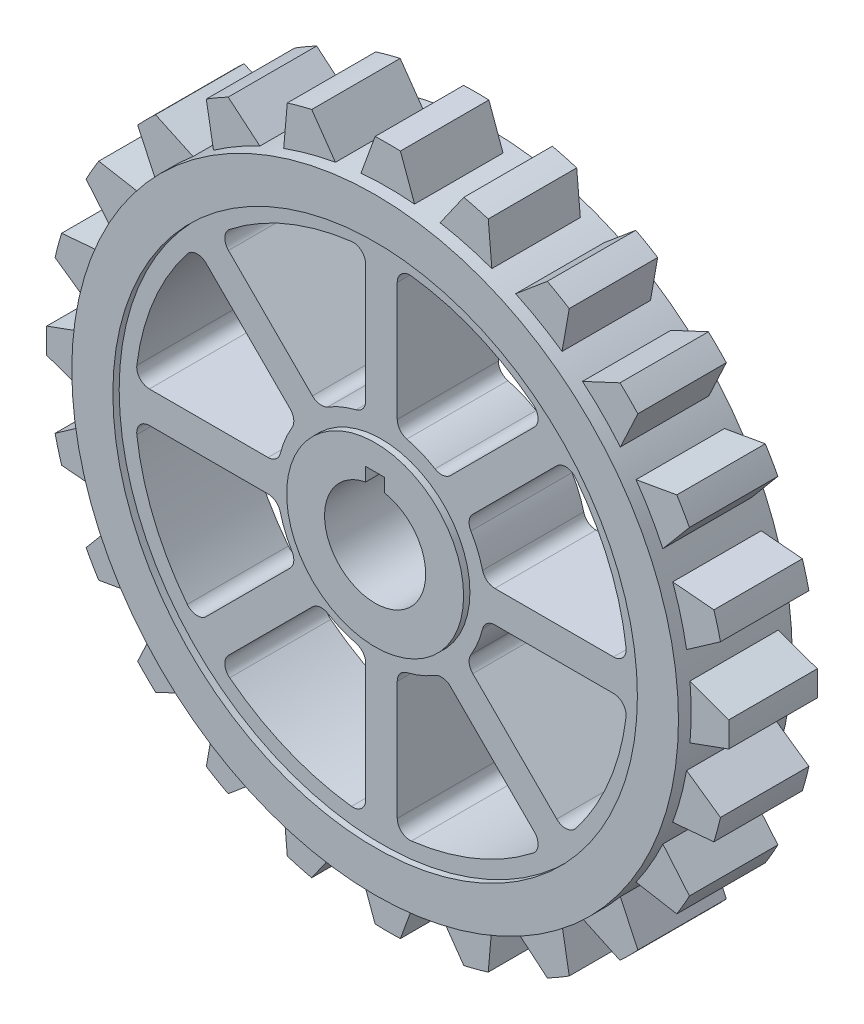
from build123d import *
from build123d.topology import SkipClean

# Parameters (mm, degrees)
BOSS_EXTRUDE3_DEPTH      = 9
BOSS_EXTRUDE3_DEPTH_BACK = 9
BOSS_EXTRUDE4_DEPTH      = 8
BOSS_EXTRUDE4_DEPTH_BACK = 8
BOSS_EXTRUDE5_DEPTH      = 9
BOSS_EXTRUDE5_DEPTH_BACK = 9
BOSS_EXTRUDE6_DEPTH      = 7
BOSS_EXTRUDE6_DEPTH_BACK = 7


with BuildPart() as part:
    # Sketch1 → Boss-Extrude3 (new, two sides: drawn at the far end of the back side and taken through both)
    with BuildSketch(Plane.XY.offset(-BOSS_EXTRUDE3_DEPTH_BACK)):
        with BuildLine():
            ThreePointArc((14, 0), (9.899494937, 9.899494937), (0, 14))
            ThreePointArc((0, 14), (-9.899494937, -9.899494937), (14, 0))
        make_face()
        with BuildLine():
            Line((-1.5, 7.858116823), (-1.5, 10))
            Line((-1.5, 10), (1.5, 10))
            Line((1.5, 10), (1.5, 7.858116823))
            ThreePointArc((1.5, 7.858116823), (0, -8), (-1.5, 7.858116823))
        make_face(mode=Mode.SUBTRACT)
    extrude(amount=BOSS_EXTRUDE3_DEPTH + BOSS_EXTRUDE3_DEPTH_BACK)

    # Sketch1<6> → Boss-Extrude4 (add, two sides: drawn at the far end of the back side and taken through both)
    with BuildSketch(Plane.XY.offset(-BOSS_EXTRUDE4_DEPTH_BACK)):
        with BuildLine():
            ThreePointArc((41.5, 0), (29.344931419, 29.344931419), (0, 41.5))
            ThreePointArc((0, 41.5), (-29.344931419, -29.344931419), (41.5, 0))
        make_face()
        with BuildLine():
            Line((-2.5, -17.944358445), (-2.5, -36.725331857))
            ThreePointArc((-2.5, -36.725331857), (-3.174572991, -38.223077911), (-4.743243243, -38.71048493))
            ThreePointArc((-4.743243243, -38.71048493), (-14.924653862, -36.031301768), (-24.018466935, -30.726425859))
            ThreePointArc((-24.018466935, -30.726425859), (-24.7830355, -29.272559678), (-24.200964244, -27.73649815))
            Line((-24.200964244, -27.73649815), (-10.920810587, -14.456344493))
            ThreePointArc((-10.920810587, -14.456344493), (-9.751687534, -13.885632203), (-8.478856806, -14.15482205))
            ThreePointArc((-8.478856806, -14.15482205), (-6.314276634, -15.244012286), (-4.013513514, -16.004427802))
            ThreePointArc((-4.013513514, -16.004427802), (-2.923140309, -16.714109074), (-2.5, -17.944358445))
        make_face(mode=Mode.SUBTRACT)
        with BuildLine():
            Line((-14.456344493, -10.920810587), (-27.73649815, -24.200964244))
            ThreePointArc((-27.73649815, -24.200964244), (-29.272559678, -24.7830355), (-30.726425859, -24.018466935))
            ThreePointArc((-30.726425859, -24.018466935), (-36.031301768, -14.924653862), (-38.71048493, -4.743243243))
            ThreePointArc((-38.71048493, -4.743243243), (-38.223077911, -3.174572991), (-36.725331857, -2.5))
            Line((-36.725331857, -2.5), (-17.944358445, -2.5))
            ThreePointArc((-17.944358445, -2.5), (-16.714109074, -2.923140309), (-16.004427802, -4.013513514))
            ThreePointArc((-16.004427802, -4.013513514), (-15.244012286, -6.314276634), (-14.15482205, -8.478856806))
            ThreePointArc((-14.15482205, -8.478856806), (-13.885632203, -9.751687534), (-14.456344493, -10.920810587))
        make_face(mode=Mode.SUBTRACT)
        with BuildLine():
            Line((10.920810587, -14.456344493), (24.200964244, -27.73649815))
            ThreePointArc((24.200964244, -27.73649815), (24.7830355, -29.272559678), (24.018466935, -30.726425859))
            ThreePointArc((24.018466935, -30.726425859), (14.924653862, -36.031301768), (4.743243243, -38.71048493))
            ThreePointArc((4.743243243, -38.71048493), (3.174572991, -38.223077911), (2.5, -36.725331857))
            Line((2.5, -36.725331857), (2.5, -17.944358445))
            ThreePointArc((2.5, -17.944358445), (2.923140309, -16.714109074), (4.013513514, -16.004427802))
            ThreePointArc((4.013513514, -16.004427802), (6.314276634, -15.244012286), (8.478856806, -14.15482205))
            ThreePointArc((8.478856806, -14.15482205), (9.751687534, -13.885632203), (10.920810587, -14.456344493))
        make_face(mode=Mode.SUBTRACT)
        with BuildLine():
            Line((17.944358445, -2.5), (36.725331857, -2.5))
            ThreePointArc((36.725331857, -2.5), (38.223077911, -3.174572991), (38.71048493, -4.743243243))
            ThreePointArc((38.71048493, -4.743243243), (36.031301768, -14.924653862), (30.726425859, -24.018466935))
            ThreePointArc((30.726425859, -24.018466935), (29.272559678, -24.7830355), (27.73649815, -24.200964244))
            Line((27.73649815, -24.200964244), (14.456344493, -10.920810587))
            ThreePointArc((14.456344493, -10.920810587), (13.885632203, -9.751687534), (14.15482205, -8.478856806))
            ThreePointArc((14.15482205, -8.478856806), (15.244012286, -6.314276634), (16.004427802, -4.013513514))
            ThreePointArc((16.004427802, -4.013513514), (16.714109074, -2.923140309), (17.944358445, -2.5))
        make_face(mode=Mode.SUBTRACT)
        with BuildLine():
            ThreePointArc((14, 0), (-9.899494937, -9.899494937), (0, 14))
            ThreePointArc((0, 14), (9.899494937, 9.899494937), (14, 0))
        make_face(mode=Mode.SUBTRACT)
        with BuildLine():
            Line((-17.944358445, 2.5), (-36.725331857, 2.5))
            ThreePointArc((-36.725331857, 2.5), (-38.223077911, 3.174572991), (-38.71048493, 4.743243243))
            ThreePointArc((-38.71048493, 4.743243243), (-36.031301768, 14.924653862), (-30.726425859, 24.018466935))
            ThreePointArc((-30.726425859, 24.018466935), (-29.272559678, 24.7830355), (-27.73649815, 24.200964244))
            Line((-27.73649815, 24.200964244), (-14.456344493, 10.920810587))
            ThreePointArc((-14.456344493, 10.920810587), (-13.885632203, 9.751687534), (-14.15482205, 8.478856806))
            ThreePointArc((-14.15482205, 8.478856806), (-15.244012286, 6.314276634), (-16.004427802, 4.013513514))
            ThreePointArc((-16.004427802, 4.013513514), (-16.714109074, 2.923140309), (-17.944358445, 2.5))
        make_face(mode=Mode.SUBTRACT)
        with BuildLine():
            Line((-2.5, 36.725331857), (-2.5, 17.944358445))
            ThreePointArc((-2.5, 17.944358445), (-2.923140309, 16.714109074), (-4.013513514, 16.004427802))
            ThreePointArc((-4.013513514, 16.004427802), (-6.314276634, 15.244012286), (-8.478856806, 14.15482205))
            ThreePointArc((-8.478856806, 14.15482205), (-9.751687534, 13.885632203), (-10.920810587, 14.456344493))
            Line((-10.920810587, 14.456344493), (-24.200964244, 27.73649815))
            ThreePointArc((-24.200964244, 27.73649815), (-24.7830355, 29.272559678), (-24.018466935, 30.726425859))
            ThreePointArc((-24.018466935, 30.726425859), (-14.924653862, 36.031301768), (-4.743243243, 38.71048493))
            ThreePointArc((-4.743243243, 38.71048493), (-3.174572991, 38.223077911), (-2.5, 36.725331857))
        make_face(mode=Mode.SUBTRACT)
        with BuildLine():
            Line((14.456344493, 10.920810587), (27.73649815, 24.200964244))
            ThreePointArc((27.73649815, 24.200964244), (29.272559678, 24.7830355), (30.726425859, 24.018466935))
            ThreePointArc((30.726425859, 24.018466935), (36.031301768, 14.924653862), (38.71048493, 4.743243243))
            ThreePointArc((38.71048493, 4.743243243), (38.223077911, 3.174572991), (36.725331857, 2.5))
            Line((36.725331857, 2.5), (17.944358445, 2.5))
            ThreePointArc((17.944358445, 2.5), (16.714109074, 2.923140309), (16.004427802, 4.013513514))
            ThreePointArc((16.004427802, 4.013513514), (15.244012286, 6.314276634), (14.15482205, 8.478856806))
            ThreePointArc((14.15482205, 8.478856806), (13.885632203, 9.751687534), (14.456344493, 10.920810587))
        make_face(mode=Mode.SUBTRACT)
        with BuildLine():
            Line((24.200964244, 27.73649815), (10.920810587, 14.456344493))
            ThreePointArc((10.920810587, 14.456344493), (9.751687534, 13.885632203), (8.478856806, 14.15482205))
            ThreePointArc((8.478856806, 14.15482205), (6.314276634, 15.244012286), (4.013513514, 16.004427802))
            ThreePointArc((4.013513514, 16.004427802), (2.923140309, 16.714109074), (2.5, 17.944358445))
            Line((2.5, 17.944358445), (2.5, 36.725331857))
            ThreePointArc((2.5, 36.725331857), (3.174572991, 38.223077911), (4.743243243, 38.71048493))
            ThreePointArc((4.743243243, 38.71048493), (14.924653862, 36.031301768), (24.018466935, 30.726425859))
            ThreePointArc((24.018466935, 30.726425859), (24.7830355, 29.272559678), (24.200964244, 27.73649815))
        make_face(mode=Mode.SUBTRACT)
    extrude(amount=BOSS_EXTRUDE4_DEPTH + BOSS_EXTRUDE4_DEPTH_BACK)

    # Sketch1<7> → Boss-Extrude5 (add, two sides: drawn at the far end of the back side and taken through both)
    with BuildSketch(Plane.XY.offset(-BOSS_EXTRUDE5_DEPTH_BACK)):
        with BuildLine():
            ThreePointArc((4.238583665, 47.812492181), (0, 48), (-4.238583665, 47.812492181))
            ThreePointArc((-4.238583665, 47.812492181), (-6.265257227, 47.589353346), (-8.280626141, 47.280347193))
            ThreePointArc((-8.280626141, 47.280347193), (-12.423314165, 46.364439662), (-16.468940999, 45.08629484))
            ThreePointArc((-16.468940999, 45.08629484), (-18.368804754, 44.346217561), (-20.23552496, 43.526124679))
            ThreePointArc((-20.23552496, 43.526124679), (-24, 41.569219382), (-27.576967221, 39.287541014))
            ThreePointArc((-27.576967221, 39.287541014), (-29.220548592, 38.080960334), (-30.811406194, 36.805668699))
            ThreePointArc((-30.811406194, 36.805668699), (-33.941125497, 33.941125497), (-36.805668699, 30.811406194))
            ThreePointArc((-36.805668699, 30.811406194), (-38.080960334, 29.220548592), (-39.287541014, 27.576967221))
            ThreePointArc((-39.287541014, 27.576967221), (-41.569219382, 24), (-43.526124679, 20.23552496))
            ThreePointArc((-43.526124679, 20.23552496), (-44.346217561, 18.368804754), (-45.08629484, 16.468940999))
            ThreePointArc((-45.08629484, 16.468940999), (-46.364439662, 12.423314165), (-47.280347193, 8.280626141))
            ThreePointArc((-47.280347193, 8.280626141), (-47.589353346, 6.265257227), (-47.812492181, 4.238583665))
            ThreePointArc((-47.812492181, 4.238583665), (-48, 0), (-47.812492181, -4.238583665))
            ThreePointArc((-47.812492181, -4.238583665), (-47.589353346, -6.265257227), (-47.280347193, -8.280626141))
            ThreePointArc((-47.280347193, -8.280626141), (-46.364439662, -12.423314165), (-45.08629484, -16.468940999))
            ThreePointArc((-45.08629484, -16.468940999), (-44.346217561, -18.368804754), (-43.526124679, -20.23552496))
            ThreePointArc((-43.526124679, -20.23552496), (-41.569219382, -24), (-39.287541014, -27.576967221))
            ThreePointArc((-39.287541014, -27.576967221), (-38.080960334, -29.220548592), (-36.805668699, -30.811406194))
            ThreePointArc((-36.805668699, -30.811406194), (-33.941125497, -33.941125497), (-30.811406194, -36.805668699))
            ThreePointArc((-30.811406194, -36.805668699), (-29.220548592, -38.080960334), (-27.576967221, -39.287541014))
            ThreePointArc((-27.576967221, -39.287541014), (-24, -41.569219382), (-20.23552496, -43.526124679))
            ThreePointArc((-20.23552496, -43.526124679), (-18.368804754, -44.346217561), (-16.468940999, -45.08629484))
            ThreePointArc((-16.468940999, -45.08629484), (-12.423314165, -46.364439662), (-8.280626141, -47.280347193))
            ThreePointArc((-8.280626141, -47.280347193), (-6.265257227, -47.589353346), (-4.238583665, -47.812492181))
            ThreePointArc((-4.238583665, -47.812492181), (0, -48), (4.238583665, -47.812492181))
            ThreePointArc((4.238583665, -47.812492181), (6.265257227, -47.589353346), (8.280626141, -47.280347193))
            ThreePointArc((8.280626141, -47.280347193), (12.423314165, -46.364439662), (16.468940999, -45.08629484))
            ThreePointArc((16.468940999, -45.08629484), (18.368804754, -44.346217561), (20.23552496, -43.526124679))
            ThreePointArc((20.23552496, -43.526124679), (24, -41.569219382), (27.576967221, -39.287541014))
            ThreePointArc((27.576967221, -39.287541014), (29.220548592, -38.080960334), (30.811406194, -36.805668699))
            ThreePointArc((30.811406194, -36.805668699), (33.941125497, -33.941125497), (36.805668699, -30.811406194))
            ThreePointArc((36.805668699, -30.811406194), (38.080960334, -29.220548592), (39.287541014, -27.576967221))
            ThreePointArc((39.287541014, -27.576967221), (41.569219382, -24), (43.526124679, -20.23552496))
            ThreePointArc((43.526124679, -20.23552496), (44.346217561, -18.368804754), (45.08629484, -16.468940999))
            ThreePointArc((45.08629484, -16.468940999), (46.364439662, -12.423314165), (47.280347193, -8.280626141))
            ThreePointArc((47.280347193, -8.280626141), (47.589353346, -6.265257227), (47.812492181, -4.238583665))
            ThreePointArc((47.812492181, -4.238583665), (47.953100133, -2.121364577), (48, 0))
            ThreePointArc((48, 0), (47.953100133, 2.121364577), (47.812492181, 4.238583665))
            ThreePointArc((47.812492181, 4.238583665), (47.589353346, 6.265257227), (47.280347193, 8.280626141))
            ThreePointArc((47.280347193, 8.280626141), (46.364439662, 12.423314165), (45.08629484, 16.468940999))
            ThreePointArc((45.08629484, 16.468940999), (44.346217561, 18.368804754), (43.526124679, 20.23552496))
            ThreePointArc((43.526124679, 20.23552496), (41.569219382, 24), (39.287541014, 27.576967221))
            ThreePointArc((39.287541014, 27.576967221), (38.080960334, 29.220548592), (36.805668699, 30.811406194))
            ThreePointArc((36.805668699, 30.811406194), (33.941125497, 33.941125497), (30.811406194, 36.805668699))
            ThreePointArc((30.811406194, 36.805668699), (29.220548592, 38.080960334), (27.576967221, 39.287541014))
            ThreePointArc((27.576967221, 39.287541014), (24, 41.569219382), (20.23552496, 43.526124679))
            ThreePointArc((20.23552496, 43.526124679), (18.368804754, 44.346217561), (16.468940999, 45.08629484))
            ThreePointArc((16.468940999, 45.08629484), (12.423314165, 46.364439662), (8.280626141, 47.280347193))
            ThreePointArc((8.280626141, 47.280347193), (6.265257227, 47.589353346), (4.238583665, 47.812492181))
        make_face()
        with BuildLine():
            ThreePointArc((41.5, 0), (-29.344931419, -29.344931419), (0, 41.5))
            ThreePointArc((0, 41.5), (29.344931419, 29.344931419), (41.5, 0))
        make_face(mode=Mode.SUBTRACT)
    extrude(amount=BOSS_EXTRUDE5_DEPTH + BOSS_EXTRUDE5_DEPTH_BACK)

    # Sketch1<8> → Boss-Extrude6 (add, two sides: drawn at the far end of the back side and taken through both)
    with SkipClean():  # the faces are left unmerged after this step: merging them gives an invalid solid
        with BuildSketch(Plane.XY.offset(-BOSS_EXTRUDE6_DEPTH_BACK)):
            with BuildLine():
                ThreePointArc((2, 53.962950253), (0, 54), (-2, 53.962950253))
                Line((-2, 53.962950253), (-4.238583665, 47.812492181))
                ThreePointArc((-4.238583665, 47.812492181), (0, 48), (4.238583665, 47.812492181))
                Line((4.238583665, 47.812492181), (2, 53.962950253))
            make_face()
            with BuildLine():
                ThreePointArc((-16.468940999, 45.08629484), (-12.423314165, 46.364439662), (-8.280626141, 47.280347193))
                Line((-8.280626141, 47.280347193), (-12.034787603, 52.641845402))
                ThreePointArc((-12.034787603, 52.641845402), (-13.976228436, 52.15999462), (-15.898490908, 51.606569222))
                Line((-15.898490908, 51.606569222), (-16.468940999, 45.08629484))
            make_face()
            with BuildLine():
                Line((12.034787603, 52.641845402), (8.280626141, 47.280347193))
                ThreePointArc((8.280626141, 47.280347193), (12.423314165, 46.364439662), (16.468940999, 45.08629484))
                Line((16.468940999, 45.08629484), (15.898490908, 51.606569222))
                ThreePointArc((15.898490908, 51.606569222), (13.976228436, 52.15999462), (12.034787603, 52.641845402))
            make_face()
            with BuildLine():
                ThreePointArc((-27.576967221, 39.287541014), (-24, 41.569219382), (-20.23552496, 43.526124679))
                Line((-20.23552496, 43.526124679), (-25.249424319, 47.733285782))
                ThreePointArc((-25.249424319, 47.733285782), (-27, 46.765371804), (-28.713525934, 45.733285782))
                Line((-28.713525934, 45.733285782), (-27.576967221, 39.287541014))
            make_face()
            with BuildLine():
                Line((25.249424319, 47.733285782), (20.23552496, 43.526124679))
                ThreePointArc((20.23552496, 43.526124679), (24, 41.569219382), (27.576967221, 39.287541014))
                Line((27.576967221, 39.287541014), (28.713525934, 45.733285782))
                ThreePointArc((28.713525934, 45.733285782), (27, 46.765371804), (25.249424319, 47.733285782))
            make_face()
            with BuildLine():
                ThreePointArc((-36.805668699, 30.811406194), (-33.941125497, 33.941125497), (-30.811406194, 36.805668699))
                Line((-30.811406194, 36.805668699), (-36.743354494, 39.571781619))
                ThreePointArc((-36.743354494, 39.571781619), (-38.183766184, 38.183766184), (-39.571781619, 36.743354494))
                Line((-39.571781619, 36.743354494), (-36.805668699, 30.811406194))
            make_face()
            with BuildLine():
                Line((36.743354494, 39.571781619), (30.811406194, 36.805668699))
                ThreePointArc((30.811406194, 36.805668699), (33.941125497, 33.941125497), (36.805668699, 30.811406194))
                Line((36.805668699, 30.811406194), (39.571781619, 36.743354494))
                ThreePointArc((39.571781619, 36.743354494), (38.183766184, 38.183766184), (36.743354494, 39.571781619))
            make_face()
            with BuildLine():
                ThreePointArc((-43.526124679, 20.23552496), (-41.569219382, 24), (-39.287541014, 27.576967221))
                Line((-39.287541014, 27.576967221), (-45.733285782, 28.713525934))
                ThreePointArc((-45.733285782, 28.713525934), (-46.765371804, 27), (-47.733285782, 25.249424319))
                Line((-47.733285782, 25.249424319), (-43.526124679, 20.23552496))
            make_face()
            with BuildLine():
                Line((45.733285782, 28.713525934), (39.287541014, 27.576967221))
                ThreePointArc((39.287541014, 27.576967221), (41.569219382, 24), (43.526124679, 20.23552496))
                Line((43.526124679, 20.23552496), (47.733285782, 25.249424319))
                ThreePointArc((47.733285782, 25.249424319), (46.765371804, 27), (45.733285782, 28.713525934))
            make_face()
            with BuildLine():
                ThreePointArc((-47.280347193, 8.280626141), (-46.364439662, 12.423314165), (-45.08629484, 16.468940999))
                Line((-45.08629484, 16.468940999), (-51.606569222, 15.898490908))
                ThreePointArc((-51.606569222, 15.898490908), (-52.15999462, 13.976228436), (-52.641845402, 12.034787603))
                Line((-52.641845402, 12.034787603), (-47.280347193, 8.280626141))
            make_face()
            with BuildLine():
                Line((51.606569222, 15.898490908), (45.08629484, 16.468940999))
                ThreePointArc((45.08629484, 16.468940999), (46.364439662, 12.423314165), (47.280347193, 8.280626141))
                Line((47.280347193, 8.280626141), (52.641845402, 12.034787603))
                ThreePointArc((52.641845402, 12.034787603), (52.15999462, 13.976228436), (51.606569222, 15.898490908))
            make_face()
            with BuildLine():
                ThreePointArc((-47.812492181, -4.238583665), (-48, 0), (-47.812492181, 4.238583665))
                Line((-47.812492181, 4.238583665), (-53.962950253, 2))
                ThreePointArc((-53.962950253, 2), (-54, 0), (-53.962950253, -2))
                Line((-53.962950253, -2), (-47.812492181, -4.238583665))
            make_face()
            with BuildLine():
                Line((53.962950253, 2), (47.812492181, 4.238583665))
                ThreePointArc((47.812492181, 4.238583665), (48, 0), (47.812492181, -4.238583665))
                Line((47.812492181, -4.238583665), (53.962950253, -2))
                ThreePointArc((53.962950253, -2), (54, 0), (53.962950253, 2))
            make_face()
            with BuildLine():
                ThreePointArc((-45.08629484, -16.468940999), (-46.364439662, -12.423314165), (-47.280347193, -8.280626141))
                Line((-47.280347193, -8.280626141), (-52.641845402, -12.034787603))
                ThreePointArc((-52.641845402, -12.034787603), (-52.15999462, -13.976228436), (-51.606569222, -15.898490908))
                Line((-51.606569222, -15.898490908), (-45.08629484, -16.468940999))
            make_face()
            with BuildLine():
                Line((52.641845402, -12.034787603), (47.280347193, -8.280626141))
                ThreePointArc((47.280347193, -8.280626141), (46.364439662, -12.423314165), (45.08629484, -16.468940999))
                Line((45.08629484, -16.468940999), (51.606569222, -15.898490908))
                ThreePointArc((51.606569222, -15.898490908), (52.15999462, -13.976228436), (52.641845402, -12.034787603))
            make_face()
            with BuildLine():
                ThreePointArc((-39.287541014, -27.576967221), (-41.569219382, -24), (-43.526124679, -20.23552496))
                Line((-43.526124679, -20.23552496), (-47.733285782, -25.249424319))
                ThreePointArc((-47.733285782, -25.249424319), (-46.765371804, -27), (-45.733285782, -28.713525934))
                Line((-45.733285782, -28.713525934), (-39.287541014, -27.576967221))
            make_face()
            with BuildLine():
                Line((47.733285782, -25.249424319), (43.526124679, -20.23552496))
                ThreePointArc((43.526124679, -20.23552496), (41.569219382, -24), (39.287541014, -27.576967221))
                Line((39.287541014, -27.576967221), (45.733285782, -28.713525934))
                ThreePointArc((45.733285782, -28.713525934), (46.765371804, -27), (47.733285782, -25.249424319))
            make_face()
            with BuildLine():
                ThreePointArc((-30.811406194, -36.805668699), (-33.941125497, -33.941125497), (-36.805668699, -30.811406194))
                Line((-36.805668699, -30.811406194), (-39.571781619, -36.743354494))
                ThreePointArc((-39.571781619, -36.743354494), (-38.183766184, -38.183766184), (-36.743354494, -39.571781619))
                Line((-36.743354494, -39.571781619), (-30.811406194, -36.805668699))
            make_face()
            with BuildLine():
                Line((39.571781619, -36.743354494), (36.805668699, -30.811406194))
                ThreePointArc((36.805668699, -30.811406194), (33.941125497, -33.941125497), (30.811406194, -36.805668699))
                Line((30.811406194, -36.805668699), (36.743354494, -39.571781619))
                ThreePointArc((36.743354494, -39.571781619), (38.183766184, -38.183766184), (39.571781619, -36.743354494))
            make_face()
            with BuildLine():
                ThreePointArc((-20.23552496, -43.526124679), (-24, -41.569219382), (-27.576967221, -39.287541014))
                Line((-27.576967221, -39.287541014), (-28.713525934, -45.733285782))
                ThreePointArc((-28.713525934, -45.733285782), (-27, -46.765371804), (-25.249424319, -47.733285782))
                Line((-25.249424319, -47.733285782), (-20.23552496, -43.526124679))
            make_face()
            with BuildLine():
                Line((28.713525934, -45.733285782), (27.576967221, -39.287541014))
                ThreePointArc((27.576967221, -39.287541014), (24, -41.569219382), (20.23552496, -43.526124679))
                Line((20.23552496, -43.526124679), (25.249424319, -47.733285782))
                ThreePointArc((25.249424319, -47.733285782), (27, -46.765371804), (28.713525934, -45.733285782))
            make_face()
            with BuildLine():
                ThreePointArc((-8.280626141, -47.280347193), (-12.423314165, -46.364439662), (-16.468940999, -45.08629484))
                Line((-16.468940999, -45.08629484), (-15.898490908, -51.606569222))
                ThreePointArc((-15.898490908, -51.606569222), (-13.976228436, -52.15999462), (-12.034787603, -52.641845402))
                Line((-12.034787603, -52.641845402), (-8.280626141, -47.280347193))
            make_face()
            with BuildLine():
                Line((15.898490908, -51.606569222), (16.468940999, -45.08629484))
                ThreePointArc((16.468940999, -45.08629484), (12.423314165, -46.364439662), (8.280626141, -47.280347193))
                Line((8.280626141, -47.280347193), (12.034787603, -52.641845402))
                ThreePointArc((12.034787603, -52.641845402), (13.976228436, -52.15999462), (15.898490908, -51.606569222))
            make_face()
            with BuildLine():
                ThreePointArc((4.238583665, -47.812492181), (0, -48), (-4.238583665, -47.812492181))
                Line((-4.238583665, -47.812492181), (-2, -53.962950253))
                ThreePointArc((-2, -53.962950253), (0, -54), (2, -53.962950253))
                Line((2, -53.962950253), (4.238583665, -47.812492181))
            make_face()
        extrude(amount=BOSS_EXTRUDE6_DEPTH + BOSS_EXTRUDE6_DEPTH_BACK)


solid = part.part
